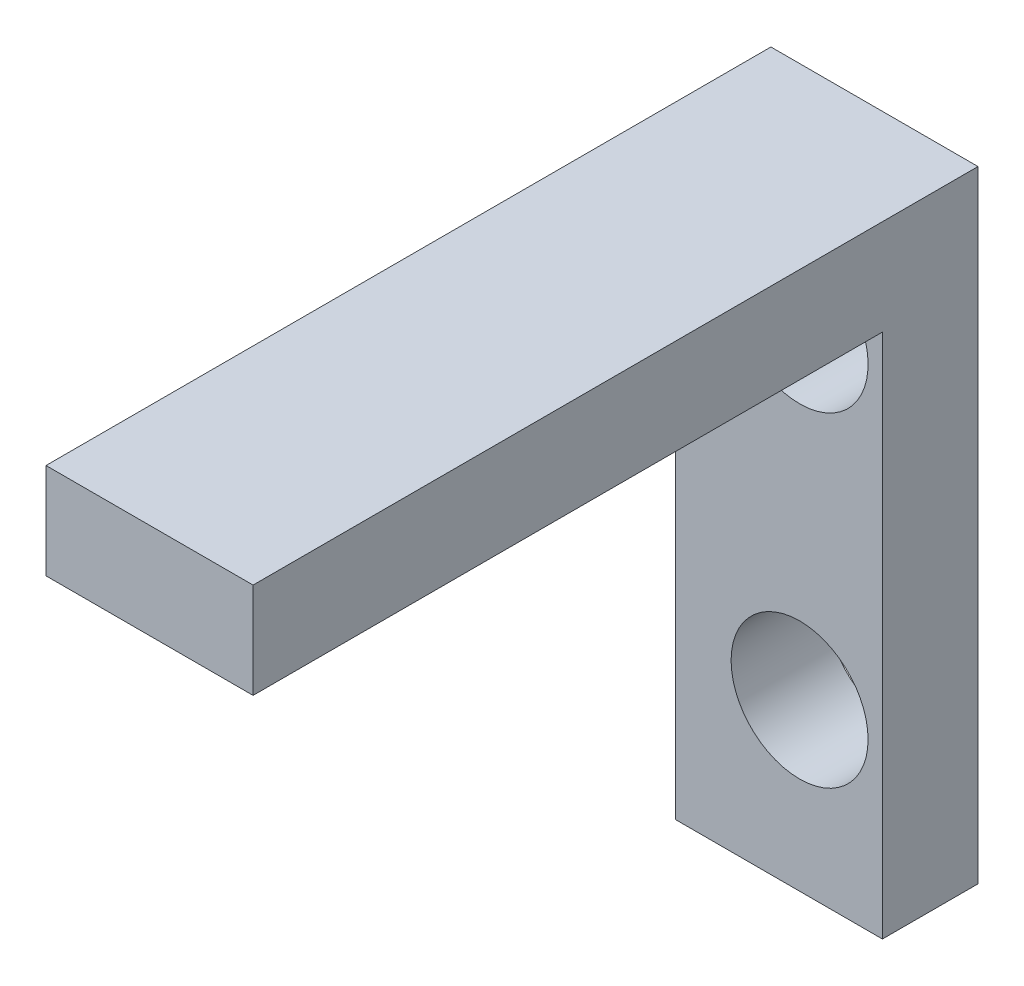
from build123d import *

# Parameters (mm, degrees)
SKETCH1_W           = 6.5
SKETCH1_H           = 19.5
BOSS_EXTRUDE1_DEPTH = 3
SKETCH6_W           = 6.5
SKETCH6_H           = 19.754729726
BOSS_EXTRUDE2_DEPTH = 3
SKETCH7_R           = 2.15
CUT_EXTRUDE1_DEPTH  = 11


with BuildPart() as part:
    # Sketch1 → Boss-Extrude1 (new body)
    with BuildSketch(Plane.XY):
        with Locations((-30.832629628, -16.171363726)):
            Rectangle(SKETCH1_W, SKETCH1_H)
    extrude(amount=BOSS_EXTRUDE1_DEPTH)

    # Sketch6 → Boss-Extrude2 (add)
    with BuildSketch(Plane(origin=(0, -6.421363726, 0), x_dir=(1, 0, 0), z_dir=(0, 1, 0))):
        with Locations((-30.832629628, -12.877364863)):
            Rectangle(SKETCH6_W, SKETCH6_H)
    extrude(amount=-BOSS_EXTRUDE2_DEPTH)

    # Sketch7 → Cut-Extrude1 (cut)
    with BuildSketch(Plane(origin=(0, 0, 0), x_dir=(-1, 0, 0), z_dir=(0, 0, -1))):
        with Locations((30.182629628, -10.521084151)):
            Circle(SKETCH7_R)
        with Locations((30.182629628, -20.721084151)):
            Circle(SKETCH7_R)
    extrude(amount=-CUT_EXTRUDE1_DEPTH, mode=Mode.SUBTRACT)


solid = part.part
